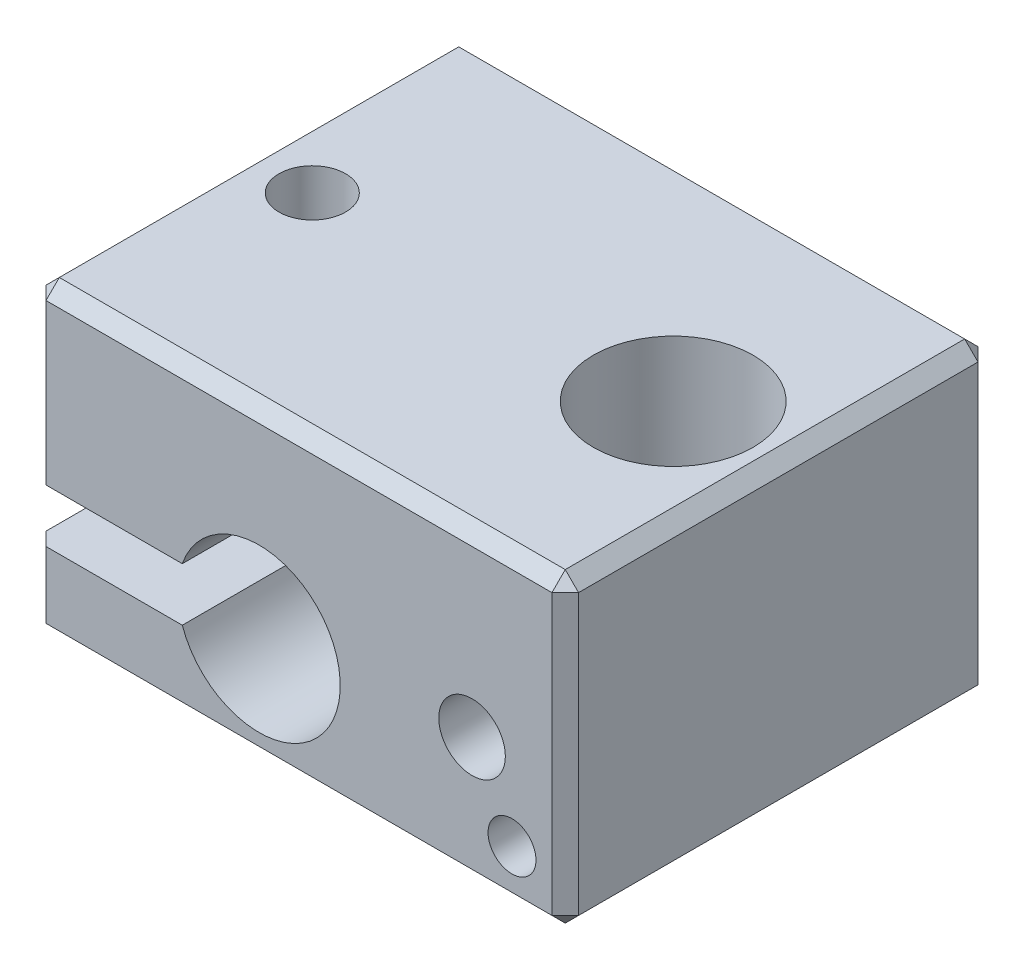
from build123d import *

# Parameters (mm, degrees)
BOSS_EXTRUDE1_DEPTH            = 8
CHAMFER1_SIZE                  = 0.5
M3X0_5_TAPPED_HOLE1_D          = 2.5
M3X0_5_TAPPED_HOLE1_DEPTH      = 3.5
M3X0_5_TAPPED_HOLE1_TIP        = 0.751075774
F_1_8_1_8_DIAMETER_HOLE1_D     = 1.8
F_1_8_1_8_DIAMETER_HOLE1_DEPTH = 2
F_1_8_1_8_DIAMETER_HOLE1_TIP   = 0.540774557
F_1_6_1_6_DIAMETER_HOLE1_D     = 1.6
F_1_6_1_6_DIAMETER_HOLE1_DEPTH = 4.5
F_1_6_1_6_DIAMETER_HOLE1_TIP   = 0.480688495
M3X0_5_TAPPED_HOLE2_D          = 2.5
M6X1_0_TAPPED_HOLE1_D          = 6


with BuildPart() as part:
    # Sketch1 → Boss-Extrude1 (new, symmetric)
    with BuildSketch(Plane.XY):
        with BuildLine():
            Line((-10, -0.75), (-4.381405907, -0.75))
            ThreePointArc((-4.381405907, -0.75), (1.55, -1.75), (-4.381405907, -2.75))
            Line((-4.381405907, -2.75), (-10, -2.75))
            Line((-10, -2.75), (-10, -5.75))
            Line((-10, -5.75), (10, -5.75))
            Line((10, -5.75), (10, 5.75))
            Line((10, 5.75), (-10, 5.75))
            Line((-10, 5.75), (-10, -0.75))
        make_face()
    extrude(amount=BOSS_EXTRUDE1_DEPTH, both=True)

    # Chamfer1
    chamfer1_edges = [part.edges().sort_by_distance(p)[0] for p in [
        (-10, 2.5, 8),
        (0, 5.75, -8),
        (10, 0, -8),
        (10, -5.75, 0),
        (-10, -5.75, 0),
        (-10, 5.75, 0),
        (10, 5.75, 0),
        (-10, -4.25, 8),
        (0, -5.75, 8),
        (10, 0, 8),
        (0, 5.75, 8),
        (0, -5.75, -8),
        (-10, -4.25, -8),
        (-10, 2.5, -8),
    ]]
    chamfer(chamfer1_edges, length=CHAMFER1_SIZE)

    # M3x0.5 Tapped Hole1
    with Locations(Plane.XY.offset(8)):
        with Locations((6.5, -0.95)):
            Hole(M3X0_5_TAPPED_HOLE1_D / 2, depth=M3X0_5_TAPPED_HOLE1_DEPTH)
            with Locations((0, 0, -(M3X0_5_TAPPED_HOLE1_DEPTH + M3X0_5_TAPPED_HOLE1_TIP / 2))):  # 118° drill point
                Cone(0, M3X0_5_TAPPED_HOLE1_D / 2, M3X0_5_TAPPED_HOLE1_TIP, mode=Mode.SUBTRACT)

    # Ø1.8 (1.8) Diameter Hole1
    with Locations(Plane.XY.offset(8)):
        with Locations((8, -3.75)):
            Hole(F_1_8_1_8_DIAMETER_HOLE1_D / 2, depth=F_1_8_1_8_DIAMETER_HOLE1_DEPTH)
            with Locations((0, 0, -(F_1_8_1_8_DIAMETER_HOLE1_DEPTH + F_1_8_1_8_DIAMETER_HOLE1_TIP / 2))):  # 118° drill point
                Cone(0, F_1_8_1_8_DIAMETER_HOLE1_D / 2, F_1_8_1_8_DIAMETER_HOLE1_TIP, mode=Mode.SUBTRACT)

    # Ø1.6 (1.6) Diameter Hole1
    with Locations(Plane.XY.offset(8)):
        with Locations((8, -3.75)):
            Hole(F_1_6_1_6_DIAMETER_HOLE1_D / 2, depth=F_1_6_1_6_DIAMETER_HOLE1_DEPTH)
            with Locations((0, 0, -(F_1_6_1_6_DIAMETER_HOLE1_DEPTH + F_1_6_1_6_DIAMETER_HOLE1_TIP / 2))):  # 118° drill point
                Cone(0, F_1_6_1_6_DIAMETER_HOLE1_D / 2, F_1_6_1_6_DIAMETER_HOLE1_TIP, mode=Mode.SUBTRACT)

    # M3x0.5 Tapped Hole2 (through all)
    with Locations(Plane(origin=(0, 5.75, 0), x_dir=(1, 0, 0), z_dir=(0, 1, 0))):
        with Locations((-7.5, 0)):
            Hole(M3X0_5_TAPPED_HOLE2_D / 2)

    # M6x1.0 Tapped Hole1 (through all)
    with Locations(Plane(origin=(0, 5.75, 0), x_dir=(1, 0, 0), z_dir=(0, 1, 0))):
        with Locations((6.053799896, 0)):
            Hole(M6X1_0_TAPPED_HOLE1_D / 2)


solid = part.part
